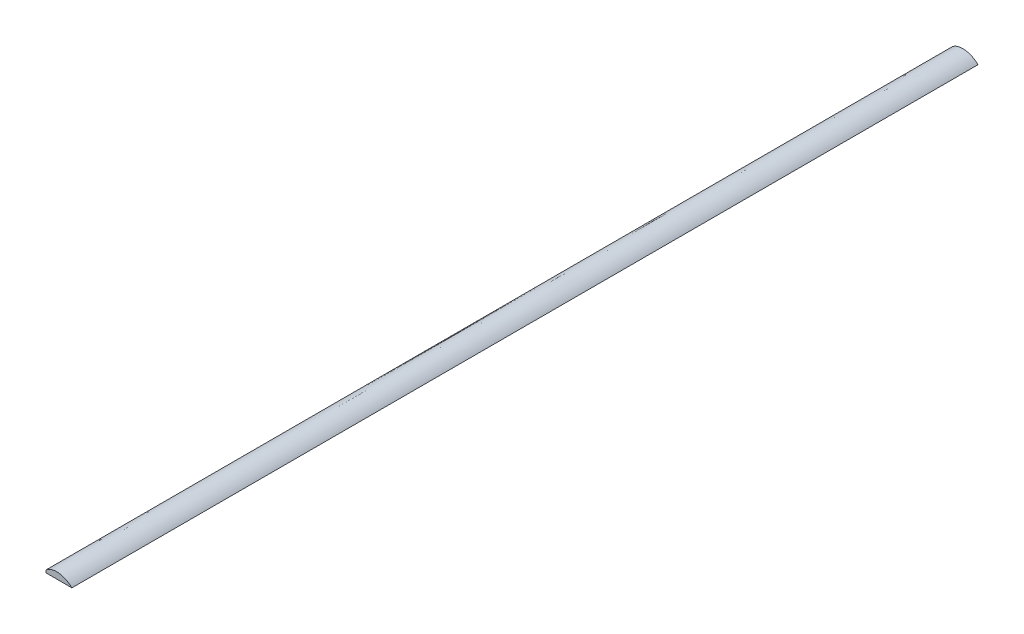
from build123d import *

# Parameters (mm, degrees)
BOSS_EXTRUDE1_DEPTH = 70


with BuildPart() as part:
    # Sketch1 → Boss-Extrude1 (new body)
    with BuildSketch(Plane.XY):
        with BuildLine():
            Line((0, 0), (2, 0))
            add(Edge.make_bspline(
                [(0, 0.2), (0.560678207, 0.70100515), (1.509225263, 0.507093259), (2, 0)],
                knots=[0, 0, 0, 0, 1, 1, 1, 1], degree=3))
            Line((0, 0.2), (0, 0))
        make_face()
    extrude(amount=-BOSS_EXTRUDE1_DEPTH)


solid = part.part
